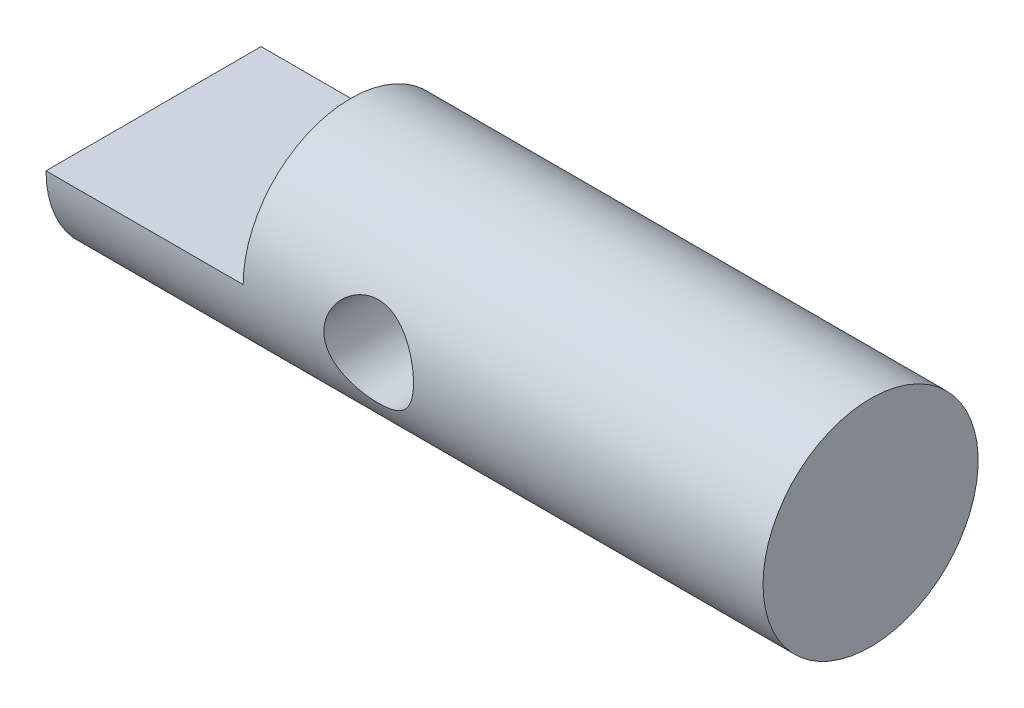
from build123d import *

# Parameters (mm, degrees)
SKETCH1_W               = 20
SKETCH1_H               = 3
CUT_EXTRUDE1_DEPTH      = 14.472308498
CUT_EXTRUDE1_DEPTH_BACK = 14.472308498
SKETCH2_W               = 5.5
SKETCH2_H               = 3
SKETCH4_R               = 1.25
CUT_EXTRUDE2_DEPTH      = 3.2


with BuildPart() as part:
    # Sketch1 → Revolve1 (revolve)
    with BuildSketch(Plane.XY, mode=Mode.PRIVATE) as revolve1_sk:
        with Locations((1.095890411, 2.52739726)):
            Rectangle(SKETCH1_W, SKETCH1_H)
    revolve(revolve1_sk.sketch.rotate(Axis((-8.904109589, 4.02739726, 0), (1, 0, 0)), 270), axis=Axis((-8.904109589, 4.02739726, 0), (1, 0, 0)))

    # Sketch2 → Cut-Extrude1 (cut, two sides: drawn at the far end of the back side and taken through both)
    with BuildSketch(Plane.XY.offset(-CUT_EXTRUDE1_DEPTH_BACK)):
        with Locations((-6.154109589, 5.52739726)):
            Rectangle(SKETCH2_W, SKETCH2_H)
    extrude(amount=CUT_EXTRUDE1_DEPTH + CUT_EXTRUDE1_DEPTH_BACK, mode=Mode.SUBTRACT)

    # Sketch4 → Cut-Extrude2 (cut)
    with BuildSketch(Plane.XY.offset(3)):
        with Locations((0.095890411, 4.02739726)):
            Circle(SKETCH4_R)
    extrude(amount=-CUT_EXTRUDE2_DEPTH, mode=Mode.SUBTRACT)


solid = part.part
